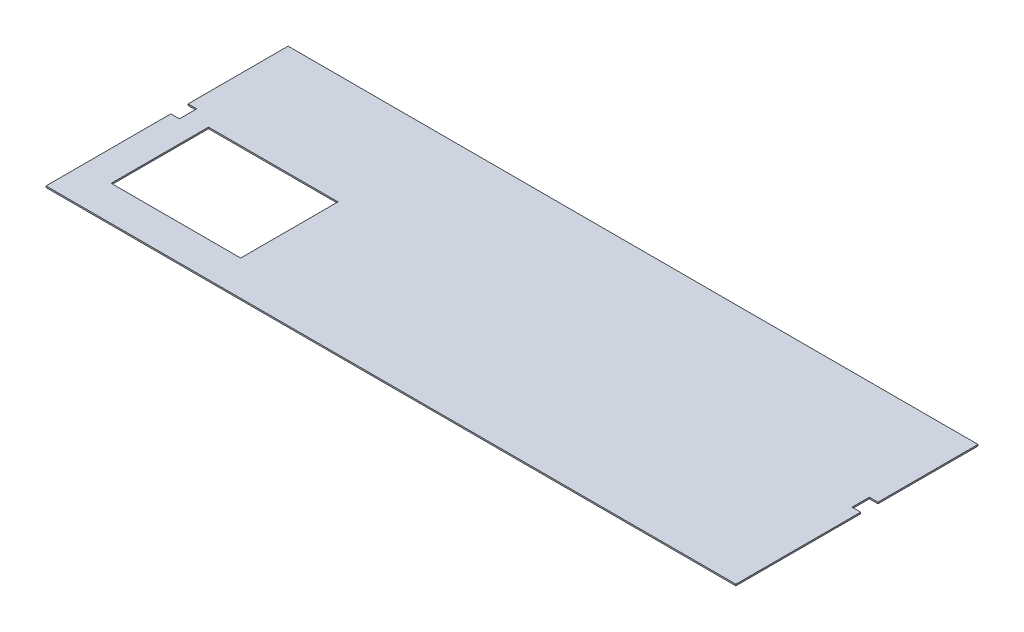
from build123d import *

# Parameters (mm, degrees)
BOSS_EXTRUDE1_DEPTH = 3.175
CUT_EXTRUDE1_REACH  = 809.569
SKETCH2_W           = 286
SKETCH2_H           = 215


with BuildPart() as part:
    # Sketch1 → Boss-Extrude1 (new body)
    with BuildSketch(Plane(origin=(0, 0, 0), x_dir=(1, 0, 0), z_dir=(0, 1, 0))):
        Polygon((-762, 46.42), (-742.95, 46.42), (-742.95, 8.32), (-762, 8.32), (-762, -267.42), (762, -267.42), (762, 8.32), (742.95, 8.32), (742.95, 46.42), (762, 46.42), (762, 267.42), (-762, 267.42), align=None)
    extrude(amount=BOSS_EXTRUDE1_DEPTH)

    # Sketch2 → Cut-Extrude1 (cut, up to next)
    with BuildSketch(Plane(origin=(0, 3.175, 0), x_dir=(1, 0, 0), z_dir=(0, 1, 0)), mode=Mode.PRIVATE) as cut_extrude1_sk1:
        with Locations((-552, -82.92)):
            Rectangle(SKETCH2_W, SKETCH2_H)
    cut_extrude1_tool1 = extrude(cut_extrude1_sk1.sketch, amount=-CUT_EXTRUDE1_REACH, mode=Mode.PRIVATE) & part.part
    add(cut_extrude1_tool1.solids().sort_by_distance((-552, 3.175, 82.92))[0], mode=Mode.SUBTRACT)


solid = part.part
